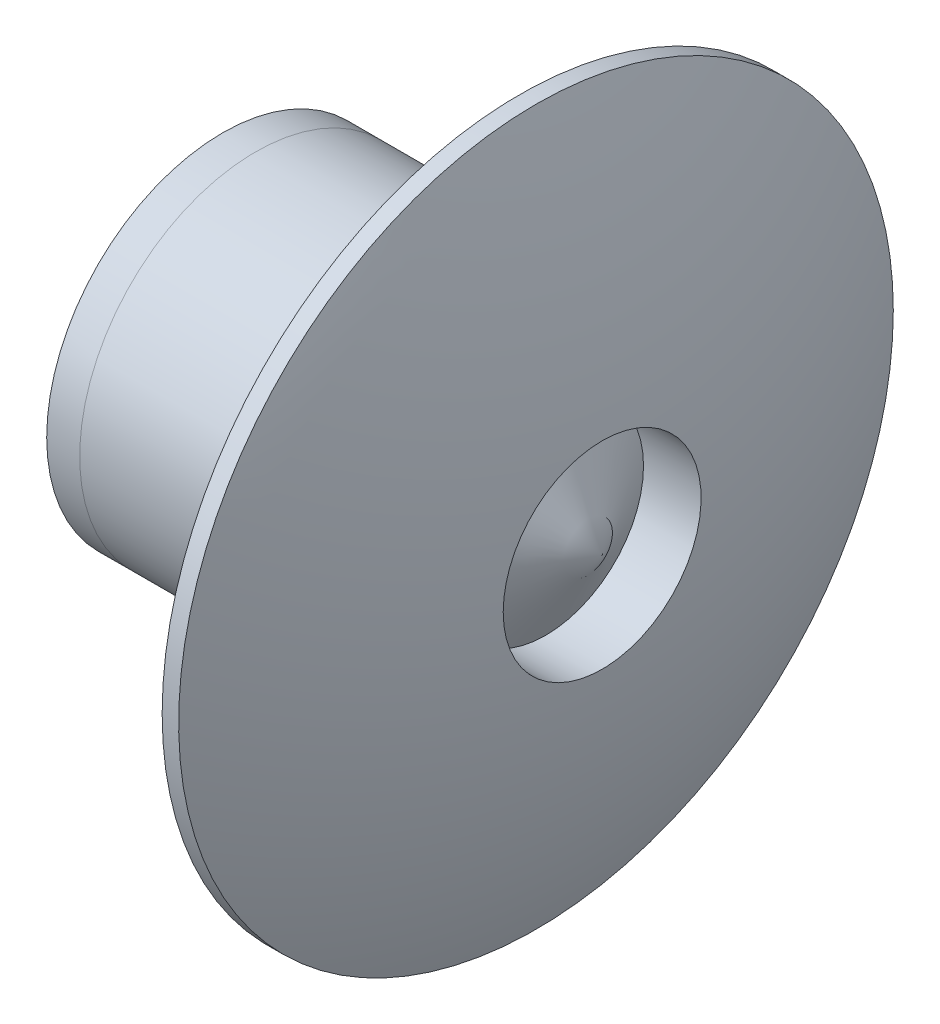
from build123d import *

# Parameters (mm, degrees)
F_1_8_1_8_DIAMETER_HOLE1_D = 1.8
CHAMFER1_SIZE              = 0.7
CHAMFER1_SIZE2             = 0.404145188


with BuildPart() as part:
    # Sketch1 → Revolve1 (revolve)
    with BuildSketch(Plane.XY, mode=Mode.PRIVATE) as revolve1_sk:
        with BuildLine():
            Line((0, 3.25), (0, 1.6))
            Line((0, 1.6), (-2.4, 1.6))
            Line((-2.4, 1.6), (-2.4, 0))
            Line((-2.4, 0), (0.8, 0))
            ThreePointArc((0.8, 0), (0.63590671, 1.657181342), (0.15, 3.25))
            Line((0.15, 3.25), (0, 3.25))
        make_face()
    revolve(revolve1_sk.sketch.rotate(Axis((0, 0, 0), (-1, 0, 0)), 90), axis=Axis((0, 0, 0), (-1, 0, 0)))

    # Ø1.8 (1.8) Diameter Hole1 (through all)
    with Locations(Plane.ZY.offset(2.4)):
        with Locations((0, 0)):
            Hole(F_1_8_1_8_DIAMETER_HOLE1_D / 2)

    # Chamfer1
    chamfer1_edges = [part.edges().sort_by_distance(p)[0] for p in [
        (-2.4, 0, 0.9),
    ]]
    chamfer1_side = [part.faces().sort_by_distance(p)[0] for p in [
        (-0.824032849, 0, 0.9),
    ]]
    chamfer(chamfer1_edges, length=CHAMFER1_SIZE, length2=CHAMFER1_SIZE2, reference=chamfer1_side[0])


with BuildPart() as body_2:
    # Sketch5 → Revolve2 (revolve)
    with BuildSketch(Plane.XY):
        with BuildLine():
            Line((0.751934301, 0), (0.238092562, 0.89))
            Line((0.238092562, 0.89), (-1.170243927, 0.89))
            Line((-1.170243927, 0.89), (-2.4, 1.6))
            Line((-2.4, 1.6), (-2.7, 1.6))
            ThreePointArc((-2.7, 1.6), (-3.027668145, 0.829639869), (-3.139555738, 0))
            Line((-3.139555738, 0), (0.751934301, 0))
        make_face()
    revolve(axis=Axis((0, 0, 0), (-1, 0, 0)))


solid = Compound([part.part, body_2.part])
